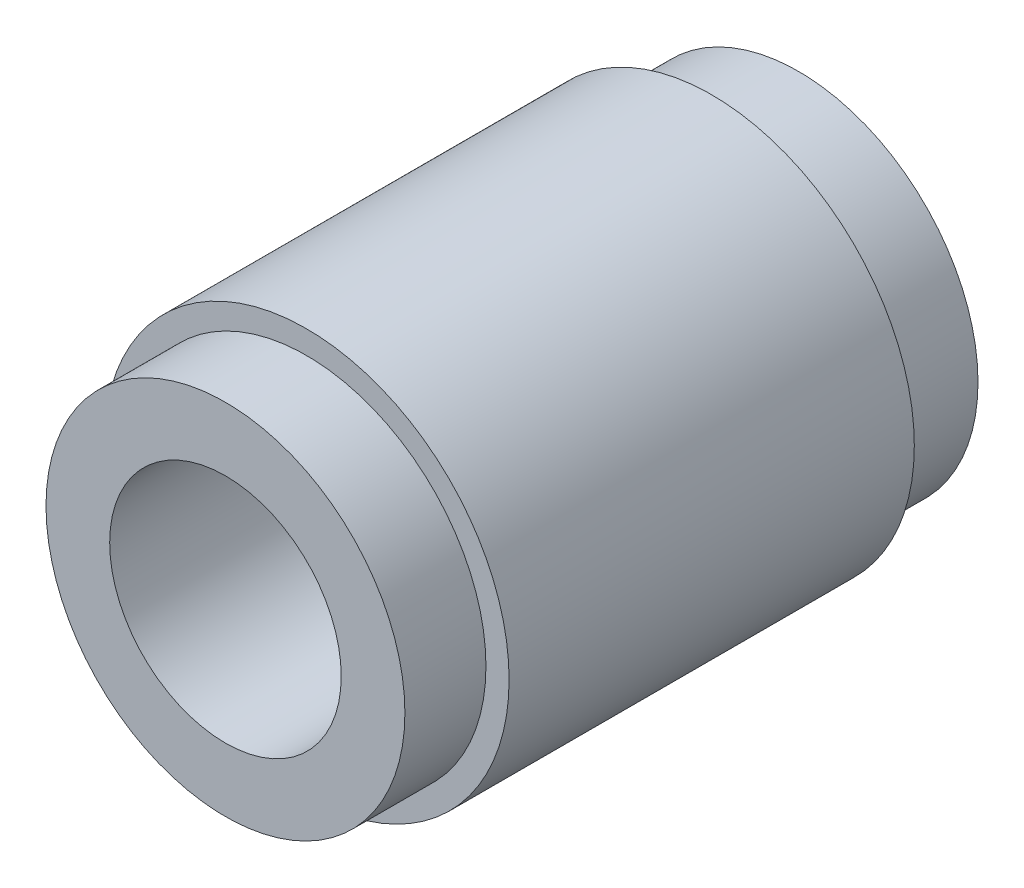
from build123d import *

# Parameters (mm, degrees)
SKETCH2_R           = 3.1
SKETCH2_R_2         = 2
BOSS_EXTRUDE1_DEPTH = 1.5
SKETCH3_R           = 3.5
SKETCH3_R_2         = 2
BOSS_EXTRUDE2_DEPTH = 7
SKETCH4_R           = 3.1
SKETCH4_R_2         = 2
BOSS_EXTRUDE3_DEPTH = 1.4


with BuildPart() as part:
    # Sketch2 → Boss-Extrude1 (new body)
    with BuildSketch(Plane.XY):
        Circle(SKETCH2_R)
        Circle(SKETCH2_R_2, mode=Mode.SUBTRACT)
    extrude(amount=BOSS_EXTRUDE1_DEPTH)

    # Sketch3 → Boss-Extrude2 (add)
    with BuildSketch(Plane.XY.offset(1.5)):
        Circle(SKETCH3_R)
        Circle(SKETCH3_R_2, mode=Mode.SUBTRACT)
    extrude(amount=BOSS_EXTRUDE2_DEPTH)

    # Sketch4 → Boss-Extrude3 (add)
    with BuildSketch(Plane.XY.offset(8.5)):
        Circle(SKETCH4_R)
        Circle(SKETCH4_R_2, mode=Mode.SUBTRACT)
    extrude(amount=BOSS_EXTRUDE3_DEPTH)


solid = part.part
